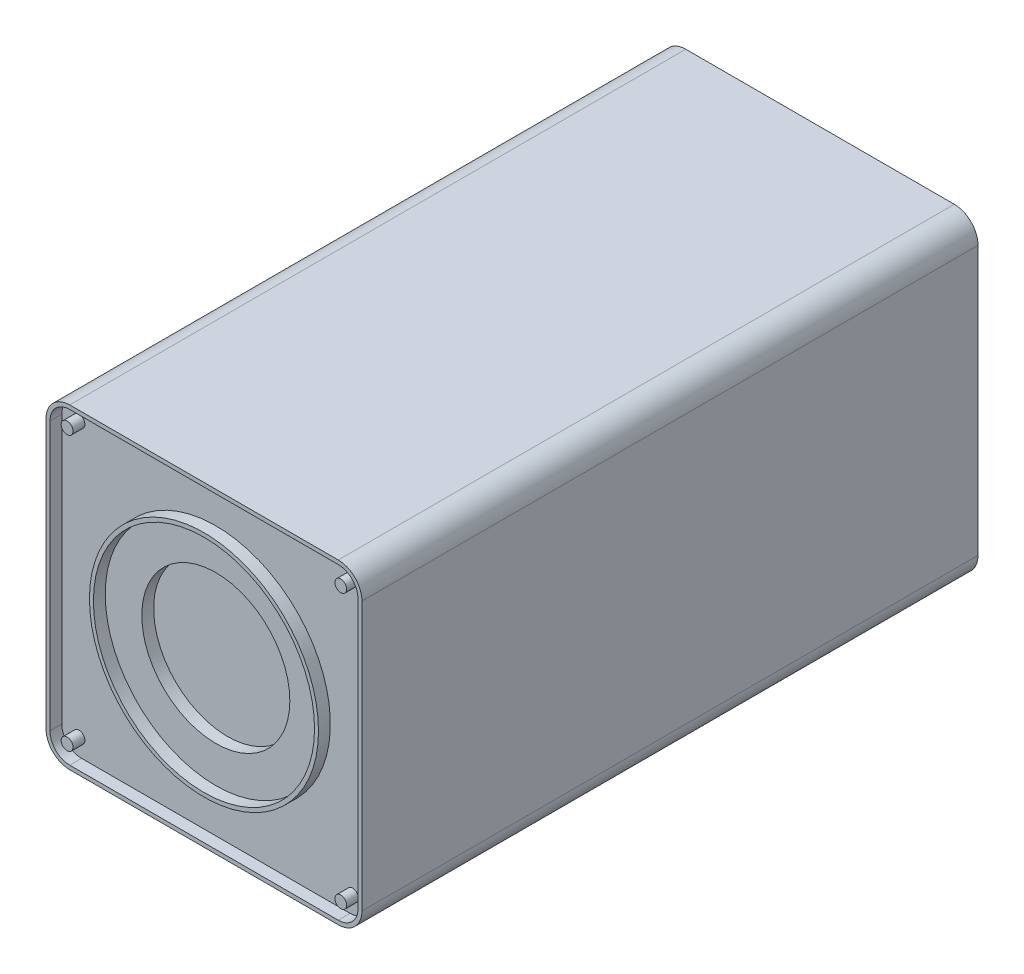
from build123d import *

# Parameters (mm, degrees)
SKETCH_2_W          = 80
SKETCH_2_H          = 80
EXTRUDE_1_DEPTH     = 150
FILLET_1_R          = 6
EXTRUDE_START       = 3
EXTRUDE_2_DEPTH     = 3
EXTRUDE_5_DEPTH     = 3
SKETCH_7_R          = 17
SKETCH_7_R_2        = 16
SKETCH_7_R_3        = 5.982349016
EXTRUDE_6_DEPTH     = 3
SKETCH_8_R          = 29
SKETCH_8_R_2        = 28
EXTRUDE_7_DEPTH     = 3
SKETCH_9_R          = 1.5
EXTRUDE_8_DEPTH     = 3
SKETCH_10_R         = 18.744403632
CUT_EXTRUDE_1_DEPTH = 3


with BuildPart() as part:
    # 草图2 → 凸台-拉伸1 (new body)
    with BuildSketch(Plane.XY):
        Rectangle(SKETCH_2_W, SKETCH_2_H)
    extrude(amount=EXTRUDE_1_DEPTH)

    # 圆角1
    fillet_1_edges = [part.edges().sort_by_distance(p)[0] for p in [
        (40, -40, 75),
        (-40, -40, 75),
        (-40, 40, 75),
        (40, 40, 75),
    ]]
    fillet(fillet_1_edges, radius=FILLET_1_R)

    # 草图3 → 凸台-拉伸2 (add)
    with BuildSketch(Plane.XY.offset(150).offset(EXTRUDE_START)):
        with BuildLine():
            Line((-40, 34), (-40, -34))
            ThreePointArc((-40, -34), (-38.242640687, -38.242640687), (-34, -40))
            Line((-34, -40), (34, -40))
            ThreePointArc((34, -40), (38.242640687, -38.242640687), (40, -34))
            Line((40, -34), (40, 34))
            ThreePointArc((40, 34), (38.242640687, 38.242640687), (34, 40))
            Line((34, 40), (-34, 40))
            ThreePointArc((-34, 40), (-38.242640687, 38.242640687), (-40, 34))
        make_face()
        with BuildLine():
            Line((34, 39), (-34, 39))
            ThreePointArc((-34, 39), (-37.535533906, 37.535533906), (-39, 34))
            Line((-39, 34), (-39, -34))
            ThreePointArc((-39, -34), (-37.535533906, -37.535533906), (-34, -39))
            Line((-34, -39), (34, -39))
            ThreePointArc((34, -39), (37.535533906, -37.535533906), (39, -34))
            Line((39, -34), (39, 34))
            ThreePointArc((39, 34), (37.535533906, 37.535533906), (34, 39))
        make_face(mode=Mode.SUBTRACT)
    extrude(amount=-EXTRUDE_2_DEPTH)

    # 草图6 → 凸台-拉伸5 (add)
    with BuildSketch(Plane(origin=(0, 0, 0), x_dir=(-1, 0, 0), z_dir=(0, 0, -1))):
        with BuildLine():
            Line((-34, -40), (34, -40))
            ThreePointArc((34, -40), (38.242640687, -38.242640687), (40, -34))
            Line((40, -34), (40, 34))
            ThreePointArc((40, 34), (38.242640687, 38.242640687), (34, 40))
            Line((34, 40), (-34, 40))
            ThreePointArc((-34, 40), (-38.242640687, 38.242640687), (-40, 34))
            Line((-40, 34), (-40, -34))
            ThreePointArc((-40, -34), (-38.242640687, -38.242640687), (-34, -40))
        make_face()
        with BuildLine():
            Line((34, 39), (-34, 39))
            ThreePointArc((-34, 39), (-37.535533906, 37.535533906), (-39, 34))
            Line((-39, 34), (-39, -34))
            ThreePointArc((-39, -34), (-37.535533906, -37.535533906), (-34, -39))
            Line((-34, -39), (34, -39))
            ThreePointArc((34, -39), (37.535533906, -37.535533906), (39, -34))
            Line((39, -34), (39, 34))
            ThreePointArc((39, 34), (37.535533906, 37.535533906), (34, 39))
        make_face(mode=Mode.SUBTRACT)
    extrude(amount=EXTRUDE_5_DEPTH)

    # 草图7 → 凸台-拉伸6 (add)
    # profile 1 of 3: a face of its own
    with BuildSketch(Plane(origin=(0, 0, 0), x_dir=(-1, 0, 0), z_dir=(0, 0, -1))):
        with Locations((0, -16)):
            Circle(SKETCH_7_R)
        with Locations((0, -16)):
            Circle(SKETCH_7_R_2, mode=Mode.SUBTRACT)
    # profile 2 of 3: a face of its own
    with BuildSketch(Plane(origin=(0, 0, 0), x_dir=(-1, 0, 0), z_dir=(0, 0, -1))):
        with Locations((15, 16)):
            Circle(SKETCH_7_R_3)
    # profile 3 of 3: a face of its own
    with BuildSketch(Plane(origin=(0, 0, 0), x_dir=(-1, 0, 0), z_dir=(0, 0, -1))):
        with Locations(Location((-15, 16, 0), (0, 0, 180))):
            Circle(SKETCH_7_R_3)
    extrude(amount=EXTRUDE_6_DEPTH)

    # 草图8 → 凸台-拉伸7 (add)
    with BuildSketch(Plane.XY.offset(150)):
        with Locations(Location((0, 0, 0), (0, 0, 180))):
            Circle(SKETCH_8_R)
        Circle(SKETCH_8_R_2, mode=Mode.SUBTRACT)
    extrude(amount=EXTRUDE_7_DEPTH)

    # 草图9 → 凸台-拉伸8 (add)
    with BuildSketch(Plane.XY.offset(150)):
        with Locations(Location((-34.649983427, 34.649983427, 0), (0, 0, 180))):
            Circle(SKETCH_9_R)
        with Locations(Location((34.649983427, 34.649983427, 0), (0, 0, 180))):
            Circle(SKETCH_9_R)
        with Locations(Location((34.649983427, -34.649983427, 0), (0, 0, 180))):
            Circle(SKETCH_9_R)
        with Locations(Location((-34.649983427, -34.649983427, 0), (0, 0, 180))):
            Circle(SKETCH_9_R)
    extrude(amount=EXTRUDE_8_DEPTH)

    # 草图10 → 切除-拉伸1 (cut)
    with BuildSketch(Plane.XY.offset(150)):
        Circle(SKETCH_10_R)
    extrude(amount=-CUT_EXTRUDE_1_DEPTH, mode=Mode.SUBTRACT)


solid = part.part
